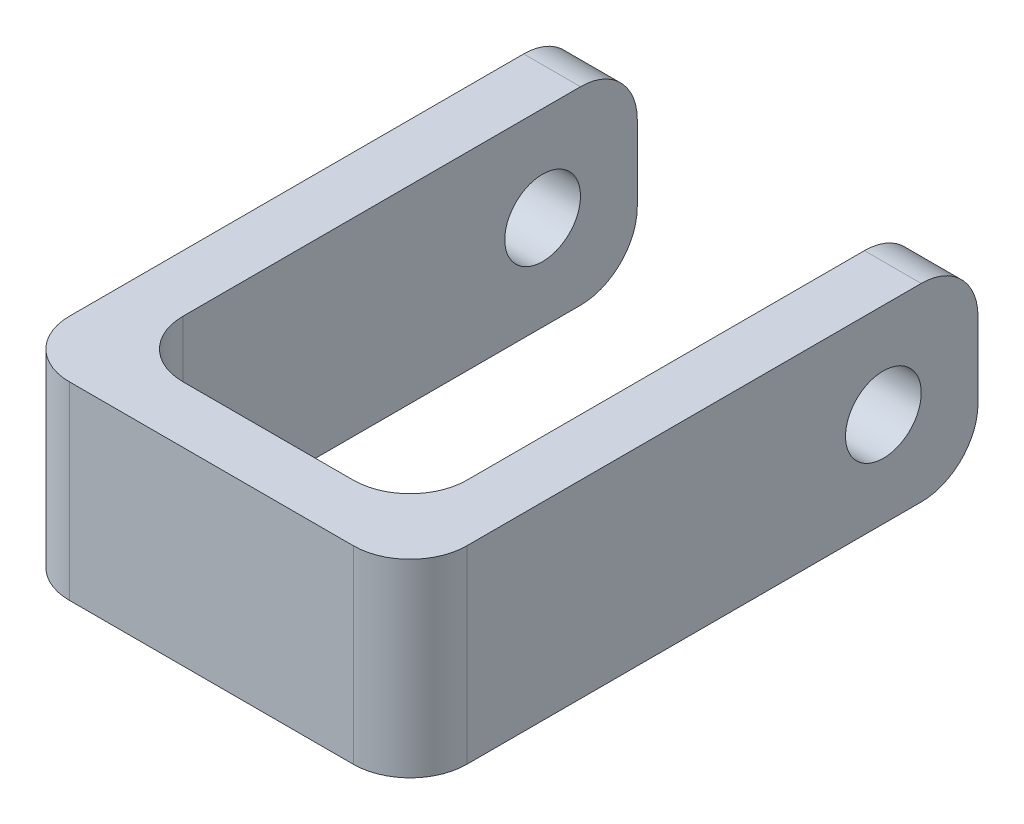
from build123d import *

# Parameters (mm, degrees)
SKETCH_1_W          = 42
SKETCH_1_H          = 20
EXTRUDE_1_DEPTH     = 60
SKETCH_3_W          = 30
SKETCH_3_H          = 54
CUT_EXTRUDE_1_DEPTH = 67.640828326
FILLET_1_R          = 6
SKETCH_4_R          = 4
CUT_EXTRUDE_2_DEPTH = 74.91887445


with BuildPart() as part:
    # 草图1 → 凸台-拉伸1 (new body)
    with BuildSketch(Plane.XY):
        Rectangle(SKETCH_1_W, SKETCH_1_H)
    extrude(amount=-EXTRUDE_1_DEPTH)

    # 草图3 → 切除-拉伸1 (cut, through all)
    with BuildSketch(Plane.XZ.offset(10)):
        with Locations((0, -33)):
            Rectangle(SKETCH_3_W, SKETCH_3_H)
    extrude(amount=-CUT_EXTRUDE_1_DEPTH, mode=Mode.SUBTRACT)

    # 圆角1
    fillet_1_edges = [part.edges().sort_by_distance(p)[0] for p in [
        (18, 10, -60),
        (-18, 10, -60),
        (18, -10, -60),
        (-15, 0, -6),
        (15, 0, -6),
        (21, 0, 0),
        (-21, 0, 0),
        (-18, -10, -60),
    ]]
    fillet(fillet_1_edges, radius=FILLET_1_R)

    # 草图4 → 切除-拉伸2 (cut, through all)
    with BuildSketch(Plane(origin=(21, 0, 0), x_dir=(0, 0, -1), z_dir=(1, 0, 0))):
        with Locations((50, 0)):
            Circle(SKETCH_4_R)
    extrude(amount=-CUT_EXTRUDE_2_DEPTH, mode=Mode.SUBTRACT)


solid = part.part
